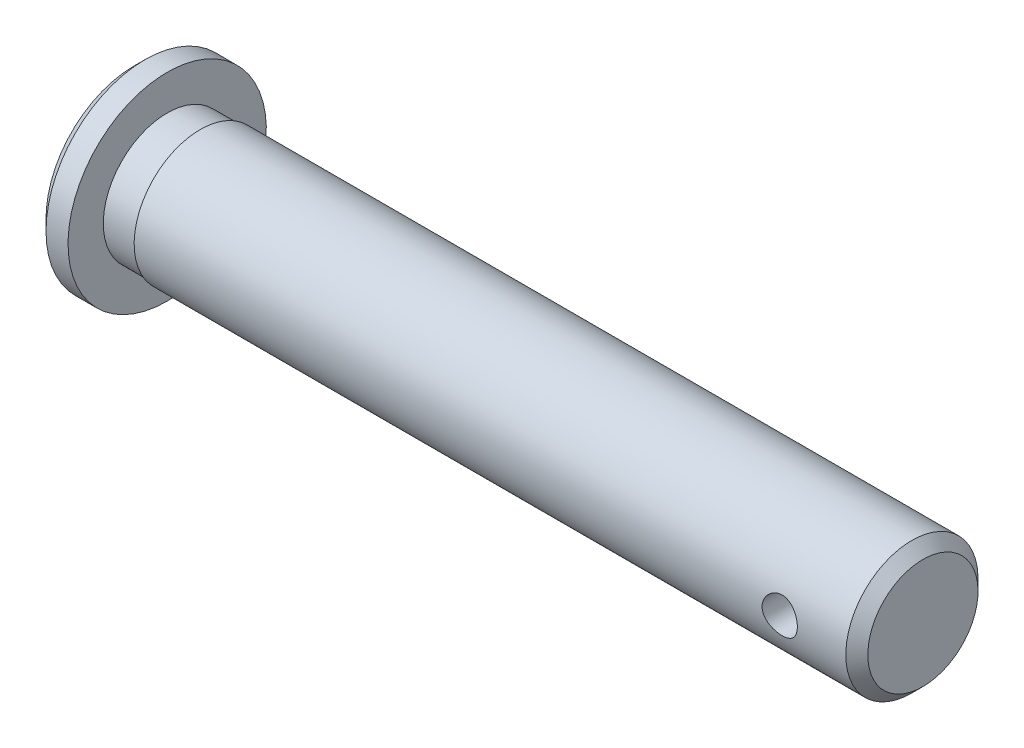
from build123d import *

# Parameters (mm, degrees)
SKETCH2_R          = 0.8
CUT_EXTRUDE1_DEPTH = 36.397598789
CHAMFER1_SIZE      = 0.5


with BuildPart() as part:
    # Sketch1 → Revolve1 (revolve)
    with BuildSketch(Plane.XY, mode=Mode.PRIVATE) as revolve1_sk:
        Polygon((-1.5, 0), (-1.5, 4.5), (0, 4.5), (0, 2.9), (1.5, 2.9), (1.5, 3), (34.3, 3), (34.3, 0), align=None)
    revolve(revolve1_sk.sketch.rotate(Axis((0, 0, 0), (1, 0, 0)), 180), axis=Axis((0, 0, 0), (1, 0, 0)))

    # Sketch2 → Cut-Extrude1 (cut, through all)
    with BuildSketch(Plane.XY.offset(3)):
        with Locations((30.8, 0)):
            Circle(SKETCH2_R)
    extrude(amount=-CUT_EXTRUDE1_DEPTH, mode=Mode.SUBTRACT)

    # Chamfer1
    chamfer1_edges = [part.edges().sort_by_distance(p)[0] for p in [
        (34.3, 3, 0),
        (-1.5, 4.5, 0),
    ]]
    chamfer(chamfer1_edges, length=CHAMFER1_SIZE)


solid = part.part
